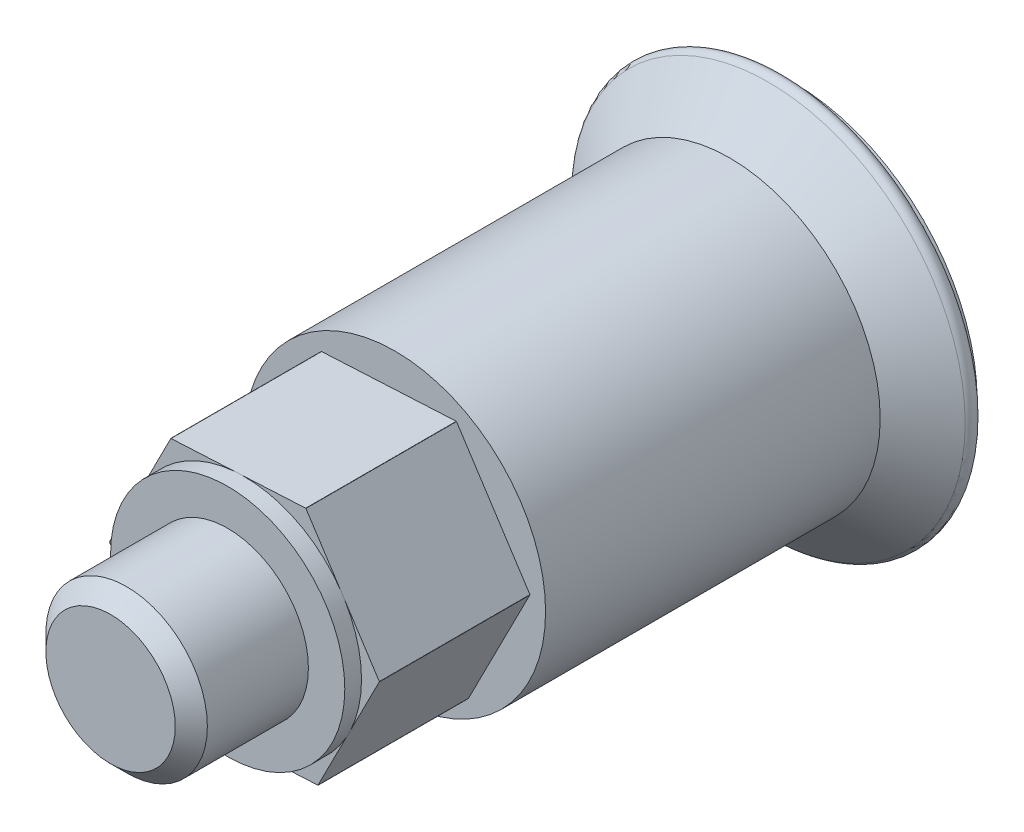
from build123d import *

# Parameters (mm, degrees)
SKETCH_1_R               = 4.5
EXTRUDE_1_DEPTH          = 10
SKETCH_1_2_R             = 4.5
EXTRUDE_2_DEPTH          = 1.6
EXTRUDE_2_DRAFT          = 50
FILLET_1_R               = 0.25
SKETCH_5_R               = 5.5
EXTRUDE_3_DEPTH          = 0.3
EXTRUDE_4_DEPTH          = 4.5
PATTERN_CIRCULAR_1_COUNT = 6
SKETCH_8_R               = 3.5
EXTRUDE_5_DEPTH          = 0.5
SKETCH_9_R               = 2.413
EXTRUDE_6_DEPTH          = 3.5
CHAMFER_1_SIZE           = 0.48


with BuildPart() as part:
    # 스케치1 → 보스-돌출1 (new body)
    with BuildSketch(Plane.XY):
        Circle(SKETCH_1_R)
    extrude(amount=EXTRUDE_1_DEPTH)


with BuildPart() as extrude_2_tool:
    # 스케치1<2> → 보스-돌출2 (with draft: the straight prism first)
    with BuildSketch(Plane.XY):
        Circle(SKETCH_1_2_R)
    extrude(amount=-EXTRUDE_2_DEPTH)
    # 보스-돌출2: the draft: its side faces are tilted about the plane it starts from
    extrude_2_sides = [extrude_2_tool.faces().sort_by_distance(p)[0] for p in [
        (-4.5, 0, -0.8),
    ]]
    draft(extrude_2_sides, Plane.XY, EXTRUDE_2_DRAFT)


with BuildPart() as part_1:
    add(part.part)

    # 보스-돌출2: add extrude_2_tool
    add(extrude_2_tool.part)

    # 필렛1
    fillet_1_edges = [part_1.edges().sort_by_distance(p)[0] for p in [
        (-6.406805748, 0, -1.6),
    ]]
    fillet(fillet_1_edges, radius=FILLET_1_R)

    # 스케치5 → 보스-돌출3 (add)
    with BuildSketch(Plane(origin=(0, 0, -1.6), x_dir=(-1, 0, 0), z_dir=(0, 0, -1))):
        Circle(SKETCH_5_R)
    extrude(amount=EXTRUDE_3_DEPTH)

    # 스케치7 → 보스-돌출4 (add)
    with BuildSketch(Plane.XY.offset(10)):
        Polygon((0, 0), (-2.201088416, 3.388936527), (1.839911584, 3.597833565), align=None)
    extrude_4 = extrude(amount=EXTRUDE_4_DEPTH)

    # 원형 패턴1: 보스-돌출4 ×6 about axis
    pattern_circular_1_axis = Axis((0, 0, 10), (0, 0, 1))
    for i in range(1, PATTERN_CIRCULAR_1_COUNT):
        add(extrude_4.rotate(pattern_circular_1_axis, i * 360 / PATTERN_CIRCULAR_1_COUNT))

    # 스케치8 → 보스-돌출5 (add)
    with BuildSketch(Plane.XY.offset(14.5)):
        Circle(SKETCH_8_R)
    extrude(amount=EXTRUDE_5_DEPTH)

    # 스케치9 → 보스-돌출6 (add)
    with BuildSketch(Plane.XY.offset(15)):
        Circle(SKETCH_9_R)
    extrude(amount=EXTRUDE_6_DEPTH)

    # 모따기1
    chamfer_1_edges = [part_1.edges().sort_by_distance(p)[0] for p in [
        (-2.413, 0, 18.5),
    ]]
    chamfer(chamfer_1_edges, length=CHAMFER_1_SIZE)


solid = part_1.part
